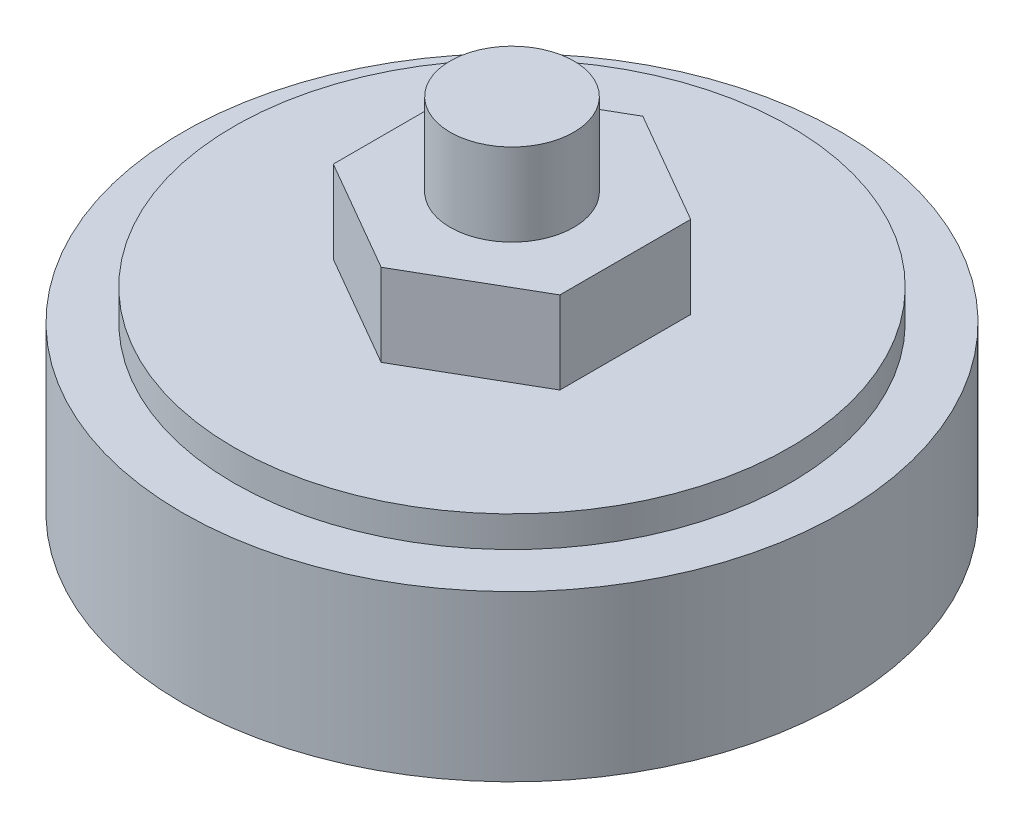
from build123d import *

# Parameters (mm, degrees)
ESQUISSE1_R        = 8
BOSS_EXTRU_1_DEPTH = 2
ESQUISSE2_R        = 6.75
BOSS_EXTRU_2_DEPTH = 2.75
BOSS_EXTRU_3_DEPTH = 2
ESQUISSE4_R        = 1.5
BOSS_EXTRU_4_DEPTH = 2


with BuildPart() as part:
    # Esquisse1 → Boss.-Extru.1 (new, symmetric)
    with BuildSketch(Plane(origin=(0, 0, 0), x_dir=(1, 0, 0), z_dir=(0, 1, 0))):
        with Locations(Location((0, 0, 0), (0, 0, 270))):
            Circle(ESQUISSE1_R)
    extrude(amount=BOSS_EXTRU_1_DEPTH, both=True)

    # Esquisse2 → Boss.-Extru.2 (add, symmetric)
    with BuildSketch(Plane(origin=(0, 0, 0), x_dir=(1, 0, 0), z_dir=(0, 1, 0))):
        with Locations(Location((0, 0, 0), (0, 0, 270))):
            Circle(ESQUISSE2_R)
    extrude(amount=BOSS_EXTRU_2_DEPTH, both=True)

    # Esquisse3 → Boss.-Extru.3 (add)
    with BuildSketch(Plane(origin=(0, 2.75, 0), x_dir=(1, 0, 0), z_dir=(0, 1, 0))):
        Polygon((0, 3.175426481), (-2.75, 1.58771324), (-2.75, -1.58771324), (0, -3.175426481), (2.75, -1.58771324), (2.75, 1.58771324), align=None)
    extrude(amount=BOSS_EXTRU_3_DEPTH)

    # Esquisse4 → Boss.-Extru.4 (add)
    with BuildSketch(Plane(origin=(0, 4.75, 0), x_dir=(1, 0, 0), z_dir=(0, 1, 0))):
        with Locations(Location((0, 0, 0), (0, 0, 270))):
            Circle(ESQUISSE4_R)
    extrude(amount=BOSS_EXTRU_4_DEPTH)


solid = part.part
